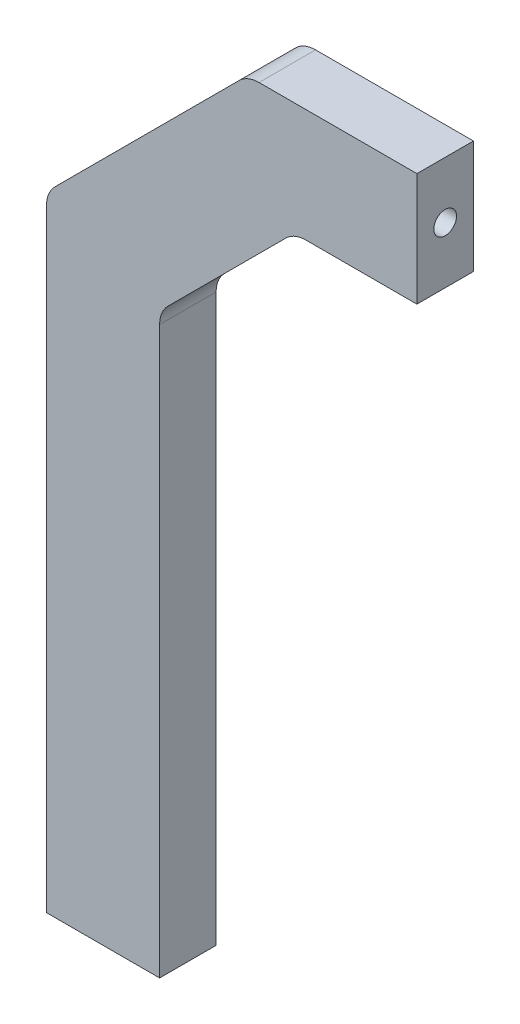
from build123d import *

# Parameters (mm, degrees)
BOSS_EXTRUDE1_DEPTH             = 6.35
FILLET1_R                       = 6.35
TAP_DRILL_FOR_1_4_20_TAP1_D     = 5.1054
TAP_DRILL_FOR_1_4_20_TAP1_DEPTH = 12.7
TAP_DRILL_FOR_1_4_20_TAP1_TIP   = 1.533816902
TAP_DRILL_FOR_1_4_20_TAP2_D     = 5.1054
TAP_DRILL_FOR_1_4_20_TAP2_DEPTH = 12.7
TAP_DRILL_FOR_1_4_20_TAP2_TIP   = 1.533816902


with BuildPart() as part:
    # Sketch1 → Boss-Extrude1 (new, symmetric)
    with BuildSketch(Plane.XY):
        Polygon((0, 12.7), (0, -12.7), (-27.578975516, -12.7), (-57.8104, -42.931424484), (-57.8104, -172.72), (-83.2104, -172.72), (-83.2104, -32.4104), (-38.1, 12.7), align=None)
    extrude(amount=BOSS_EXTRUDE1_DEPTH, both=True)

    # Fillet1
    fillet1_edges = [part.edges().sort_by_distance(p)[0] for p in [
        (-27.578975516, -12.7, 0),
        (-57.8104, -42.931424484, 0),
        (-83.2104, -32.4104, 0),
        (-38.1, 12.7, 0),
    ]]
    fillet(fillet1_edges, radius=FILLET1_R)

    # Tap Drill for 1/4-20 Tap1
    with Locations(Plane(origin=(0, 0, 0), x_dir=(0, 0, -1), z_dir=(1, 0, 0))):
        with Locations((0, 0)):
            Hole(TAP_DRILL_FOR_1_4_20_TAP1_D / 2, depth=TAP_DRILL_FOR_1_4_20_TAP1_DEPTH)
            with Locations((0, 0, -(TAP_DRILL_FOR_1_4_20_TAP1_DEPTH + TAP_DRILL_FOR_1_4_20_TAP1_TIP / 2))):  # 118° drill point
                Cone(0, TAP_DRILL_FOR_1_4_20_TAP1_D / 2, TAP_DRILL_FOR_1_4_20_TAP1_TIP, mode=Mode.SUBTRACT)

    # Tap Drill for 1/4-20 Tap2
    with Locations(Plane(origin=(0, -172.72, 0), x_dir=(-1, 0, 0), z_dir=(0, -1, 0))):
        with Locations((70.5104, 0)):
            Hole(TAP_DRILL_FOR_1_4_20_TAP2_D / 2, depth=TAP_DRILL_FOR_1_4_20_TAP2_DEPTH)
            with Locations((0, 0, -(TAP_DRILL_FOR_1_4_20_TAP2_DEPTH + TAP_DRILL_FOR_1_4_20_TAP2_TIP / 2))):  # 118° drill point
                Cone(0, TAP_DRILL_FOR_1_4_20_TAP2_D / 2, TAP_DRILL_FOR_1_4_20_TAP2_TIP, mode=Mode.SUBTRACT)


solid = part.part
